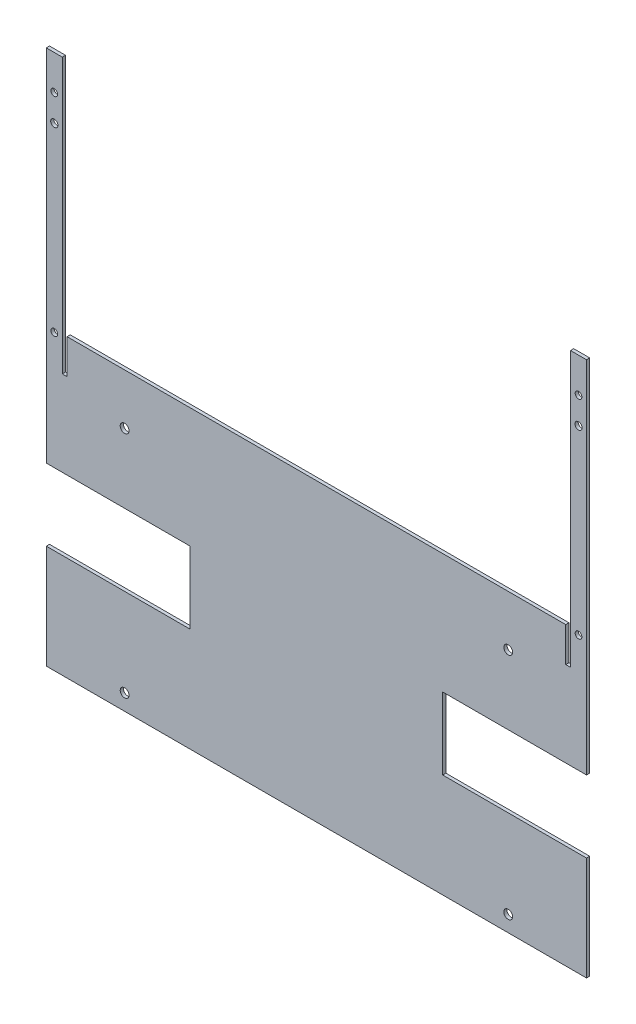
from build123d import *

# Parameters (mm, degrees)
ESQUISSE1_W             = 338
ESQUISSE1_H             = 335
BOSS_EXTRU_1_DEPTH      = 2
ESQUISSE2_W             = 318
ESQUISSE2_H             = 150
ESQUISSE2_W_2           = 90
ESQUISSE2_H_2           = 45
ENL_V_MAT_EXTRU_1_DEPTH = 238.952201082
D_GAGEMENT_M41_D        = 4.5
ESQUISSE5_W             = 3
ESQUISSE5_H             = 21.67
ENL_V_MAT_EXTRU_2_DEPTH = 238.952201082
ESQUISSE6_R             = 2.1
ENL_V_MAT_EXTRU_3_DEPTH = 238.952201082
ESQUISSE7_R             = 2.75
ENL_V_MAT_EXTRU_4_DEPTH = 238.952201082


with BuildPart() as part:
    # Esquisse1 → Boss.-Extru.1 (new body)
    with BuildSketch(Plane.XY):
        Rectangle(ESQUISSE1_W, ESQUISSE1_H)
    extrude(amount=BOSS_EXTRU_1_DEPTH)

    # Esquisse2 → Enlèv. mat.-Extru.1 (cut, through all)
    with BuildSketch(Plane.XY.offset(2)):
        with Locations((0, 92.5)):
            Rectangle(ESQUISSE2_W, ESQUISSE2_H)
        with Locations((124, -80)):
            Rectangle(ESQUISSE2_W_2, ESQUISSE2_H_2)
        with Locations((-124, -80)):
            Rectangle(ESQUISSE2_W_2, ESQUISSE2_H_2)
    extrude(amount=-ENL_V_MAT_EXTRU_1_DEPTH, mode=Mode.SUBTRACT)

    # Dégagement M41 (through all)
    with Locations(Plane.XY.offset(2)):
        with Locations((164, 129.17), (-164, 129.17)):
            Hole(D_GAGEMENT_M41_D / 2)

    # Esquisse5 → Enlèv. mat.-Extru.2 (cut, through all)
    with BuildSketch(Plane.XY.offset(2)):
        with Locations((157.5, 6.665)):
            Rectangle(ESQUISSE5_W, ESQUISSE5_H)
        with Locations((-157.5, 6.665)):
            Rectangle(ESQUISSE5_W, ESQUISSE5_H)
    extrude(amount=-ENL_V_MAT_EXTRU_2_DEPTH, mode=Mode.SUBTRACT)

    # Esquisse6 → Enlèv. mat.-Extru.3 (cut, through all)
    with BuildSketch(Plane.XY.offset(2)):
        with Locations((-164, 15.83)):
            Circle(ESQUISSE6_R)
        with Locations((-164, 145.83)):
            Circle(ESQUISSE6_R)
        with Locations(Location((164, 15.83, 0), (0, 0, 180))):
            Circle(ESQUISSE6_R)
        with Locations(Location((164, 145.83, 0), (0, 0, 180))):
            Circle(ESQUISSE6_R)
    extrude(amount=-ENL_V_MAT_EXTRU_3_DEPTH, mode=Mode.SUBTRACT)

    # Esquisse7 → Enlèv. mat.-Extru.4 (cut, through all)
    with BuildSketch(Plane.XY.offset(2)):
        with Locations((-120, -157.5)):
            Circle(ESQUISSE7_R)
        with Locations((-120, -14.17)):
            Circle(ESQUISSE7_R)
        with Locations(Location((120, -14.17, 0), (0, 0, 180))):
            Circle(ESQUISSE7_R)
        with Locations(Location((120, -157.5, 0), (0, 0, 180))):
            Circle(ESQUISSE7_R)
    extrude(amount=-ENL_V_MAT_EXTRU_4_DEPTH, mode=Mode.SUBTRACT)


solid = part.part
